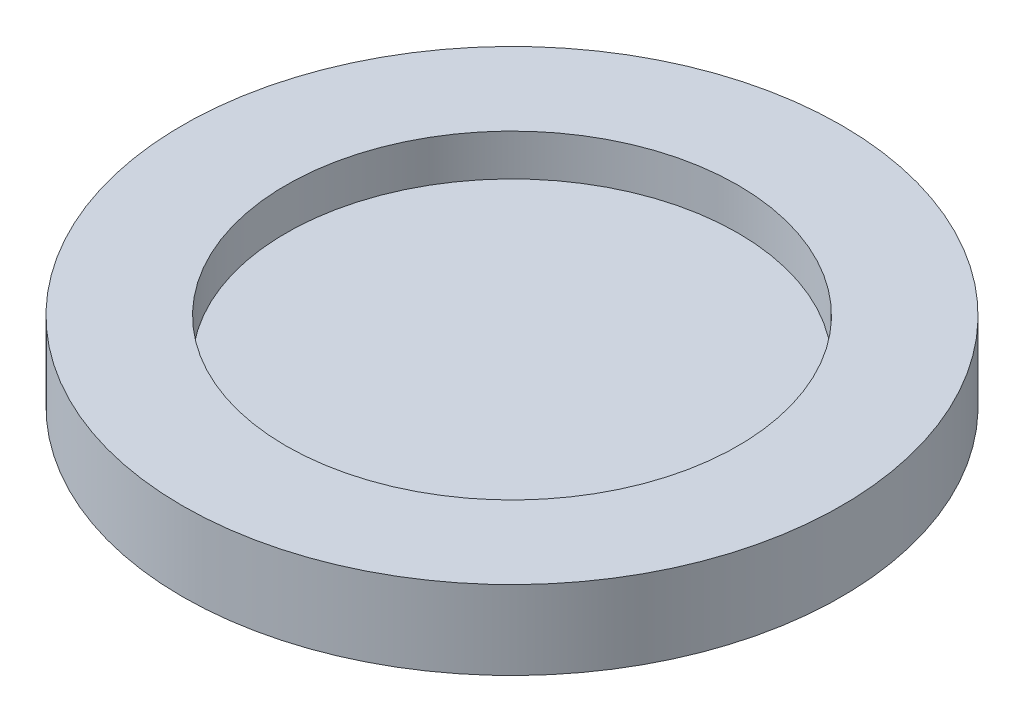
from build123d import *

# Parameters (mm, degrees)
ESQUISSE1_R        = 7.95
ESQUISSE1_R_2      = 5.45
BOSS_EXTRU_1_DEPTH = 1.9
ESQUISSE3_R        = 5.45
BOSS_EXTRU_2_DEPTH = 0.9


with BuildPart() as part:
    # Esquisse1 → Boss.-Extru.1 (new body)
    with BuildSketch(Plane(origin=(0, 0, 0), x_dir=(1, 0, 0), z_dir=(0, 1, 0))):
        with Locations(Location((0, 0, 0), (0, 0, 90))):
            Circle(ESQUISSE1_R)
        with Locations(Location((0, 0, 0), (0, 0, 90))):
            Circle(ESQUISSE1_R_2, mode=Mode.SUBTRACT)
    extrude(amount=BOSS_EXTRU_1_DEPTH)

    # Esquisse3 → Boss.-Extru.2 (add)
    with BuildSketch(Plane(origin=(0, 0, 0), x_dir=(1, 0, 0), z_dir=(0, 1, 0))):
        with Locations(Location((0, 0, 0), (0, 0, 90))):
            Circle(ESQUISSE3_R)
    extrude(amount=BOSS_EXTRU_2_DEPTH)


solid = part.part
